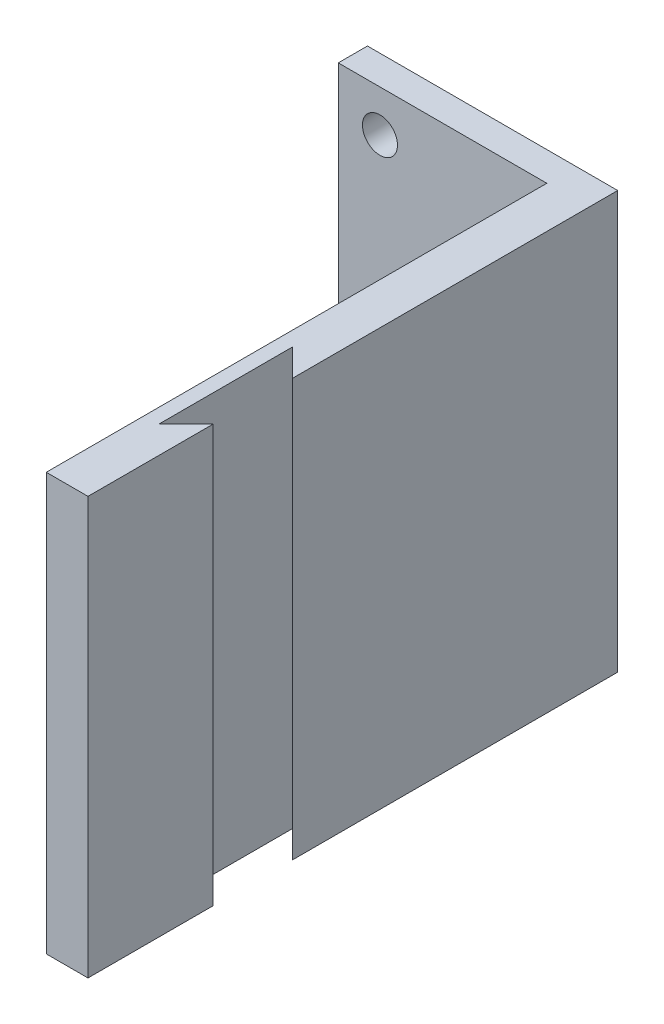
from build123d import *

# Parameters (mm, degrees)
SKETCH_2_W          = 30
SKETCH_2_H          = 50
SKETCH_2_R          = 2.1
EXTRUDE_1_DEPTH     = 3.5
SKETCH_3_W          = 5
SKETCH_3_H          = 50
EXTRUDE_2_DEPTH     = 60
CUT_EXTRUDE_1_REACH = 84.202


with BuildPart() as part:
    # 草图2 → 凸台-拉伸1 (new body)
    with BuildSketch(Plane.XY):
        Rectangle(SKETCH_2_W, SKETCH_2_H)
        with Locations((-10, -20)):
            Circle(SKETCH_2_R, mode=Mode.SUBTRACT)
        with Locations(Location((-10, 20, 0), (0, 0, 180))):
            Circle(SKETCH_2_R, mode=Mode.SUBTRACT)
    extrude(amount=EXTRUDE_1_DEPTH)

    # 草图3 → 凸台-拉伸2 (add)
    with BuildSketch(Plane.XY.offset(3.5)):
        with Locations((12.5, 0)):
            Rectangle(SKETCH_3_W, SKETCH_3_H)
    extrude(amount=EXTRUDE_2_DEPTH)

    # 草图6 → 切除-拉伸1 (cut, up to next)
    with BuildSketch(Plane.XZ.offset(25), mode=Mode.PRIVATE) as cut_extrude_1_sk1:
        Polygon((15, 48.5), (11.75, 51.75), (11.75, 35.75), (15, 39), align=None)
    cut_extrude_1_tool1 = extrude(cut_extrude_1_sk1.sketch, amount=-CUT_EXTRUDE_1_REACH, mode=Mode.PRIVATE) & part.part
    add(cut_extrude_1_tool1.solids().sort_by_distance((13.236928, -25, 43.75))[0], mode=Mode.SUBTRACT)


solid = part.part
